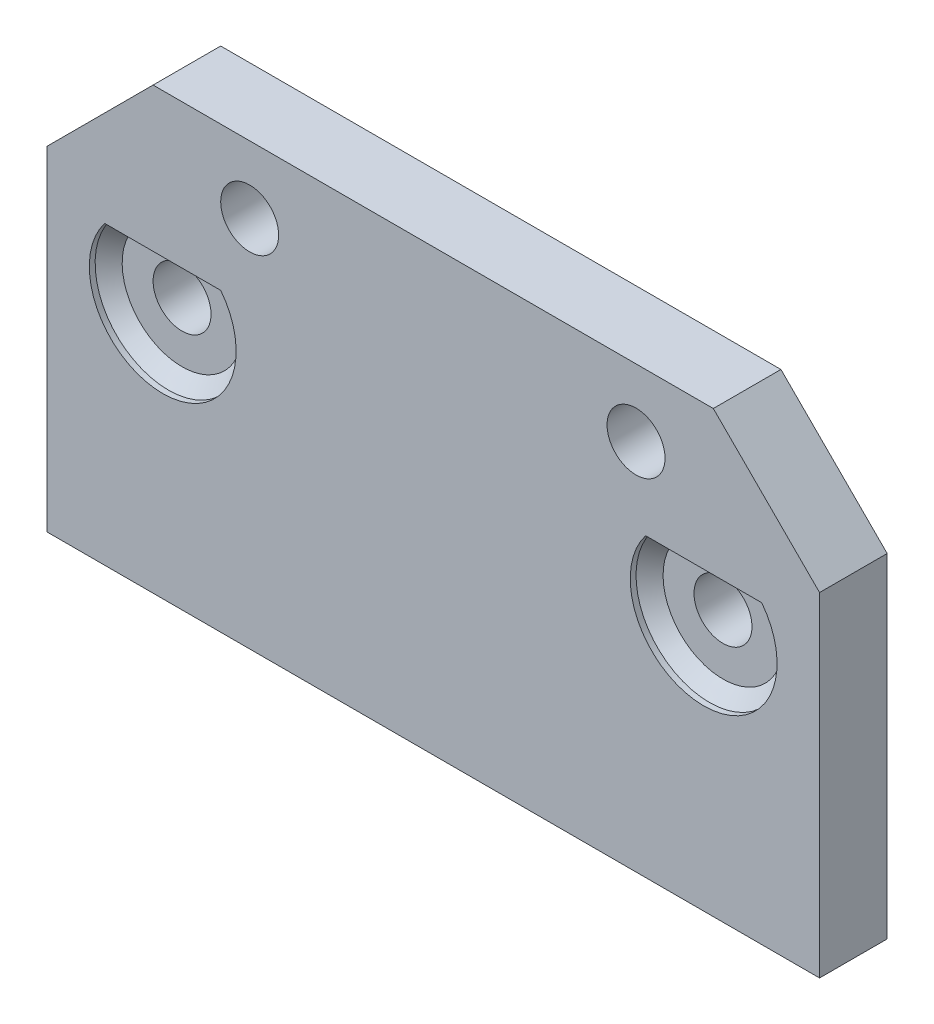
from build123d import *

# Parameters (mm, degrees)
SKETCH_1_W          = 40
SKETCH_1_H          = 2.5
EXTRUDE_1_DEPTH     = 18.5
SKETCH_2_R          = 1.5
CUT_EXTRUDE_1_DEPTH = 33.958808433
SKETCH_3_R          = 1.5
CUT_EXTRUDE_2_DEPTH = 40
SKETCH_4_W          = 40
SKETCH_4_H          = 5.719865779
CUT_EXTRUDE_3_DEPTH = 40
SKETCH_5_W          = 40
SKETCH_5_H          = 12.780134221
EXTRUDE_2_DEPTH     = 1
SKETCH_6_R          = 1.5
CUT_EXTRUDE_4_DEPTH = 31.221927206
SKETCH_8_W          = 40
SKETCH_8_H          = 3.5
EXTRUDE_3_DEPTH     = 5
SKETCH_9_R          = 3.8
CUT_EXTRUDE_5_DEPTH = 1
SKETCH_10_W         = 12
SKETCH_10_H         = 17.780134221
CUT_EXTRUDE_6_DEPTH = 1.5
CHAMFER_3_SIZE      = 0.7
CUT_EXTRUDE_7_DEPTH = 31.221927206
SKETCH_12_W         = 40
SKETCH_12_H         = 1.953894505
EXTRUDE_5_DEPTH     = 2
SKETCH_13_W         = 40
SKETCH_13_H         = 3.5
EXTRUDE_6_DEPTH     = 5
SKETCH_14_W         = 12
SKETCH_14_H         = 4.371099825
EXTRUDE_7_DEPTH     = 2
SKETCH_15_W         = 12
SKETCH_15_H         = 1.544999831
EXTRUDE_8_DEPTH     = 2


with BuildPart() as part:
    # Эскиз1 → Бобышка-Вытянуть1 (new body)
    with BuildSketch(Plane(origin=(0, 0, 0), x_dir=(1, 0, 0), z_dir=(0, 1, 0))):
        with Locations((7.162162162, 1.25)):
            Rectangle(SKETCH_1_W, SKETCH_1_H)
    extrude(amount=EXTRUDE_1_DEPTH)

    # Эскиз2 → Вырез-Вытянуть1 (cut, through all)
    with BuildSketch(Plane.XY):
        with Locations((-6.837837838, 3)):
            Circle(SKETCH_2_R)
        with Locations((21.162162162, 3)):
            Circle(SKETCH_2_R)
    extrude(amount=-CUT_EXTRUDE_1_DEPTH, mode=Mode.SUBTRACT)

    # Эскиз3 → Вырез-Вытянуть2 (cut)
    with BuildSketch(Plane.XY):
        with Locations((-2.337837838, 9.3)):
            Circle(SKETCH_3_R)
        with Locations((17.662162162, 9.3)):
            Circle(SKETCH_3_R)
    extrude(amount=-CUT_EXTRUDE_2_DEPTH, mode=Mode.SUBTRACT)

    # Эскиз4 → Вырез-Вытянуть3 (cut)
    with BuildSketch(Plane.XY):
        with Locations((7.162162162, 15.640067111)):
            Rectangle(SKETCH_4_W, SKETCH_4_H)
    extrude(amount=-CUT_EXTRUDE_3_DEPTH, mode=Mode.SUBTRACT)

    # Эскиз5 → Бобышка-Вытянуть2 (add)
    with BuildSketch(Plane.XY):
        with Locations((7.162162162, 6.390067111)):
            Rectangle(SKETCH_5_W, SKETCH_5_H)
    extrude(amount=EXTRUDE_2_DEPTH)

    # Эскиз6 → Вырез-Вытянуть4 (cut, through all)
    with BuildSketch(Plane(origin=(0, 0, -2.5), x_dir=(-1, 0, 0), z_dir=(0, 0, -1))):
        with Locations(Location((-17.662162162, 9.3, 0), (0, 0, 180))):
            Circle(SKETCH_6_R)
        with Locations(Location((2.337837838, 9.3, 0), (0, 0, 180))):
            Circle(SKETCH_6_R)
        with Locations(Location((6.837837838, 3, 0), (0, 0, 180))):
            Circle(SKETCH_6_R)
        with Locations(Location((-21.162162162, 3, 0), (0, 0, 180))):
            Circle(SKETCH_6_R)
    extrude(amount=-CUT_EXTRUDE_4_DEPTH, mode=Mode.SUBTRACT)

    # Эскиз8 → Бобышка-Вытянуть3 (add)
    with BuildSketch(Plane.XZ):
        with Locations((7.162162162, -0.75)):
            Rectangle(SKETCH_8_W, SKETCH_8_H)
    extrude(amount=EXTRUDE_3_DEPTH)

    # Эскиз9 → Вырез-Вытянуть5 (cut)
    with BuildSketch(Plane.XY.offset(1)):
        with Locations((-6.837837838, 3)):
            Circle(SKETCH_9_R)
        with Locations((21.162162162, 3)):
            Circle(SKETCH_9_R)
    extrude(amount=-CUT_EXTRUDE_5_DEPTH, mode=Mode.SUBTRACT)

    # Эскиз10 → Вырез-Вытянуть6 (cut)
    with BuildSketch(Plane(origin=(0, 0, -2.5), x_dir=(-1, 0, 0), z_dir=(0, 0, -1))):
        with Locations((-7.662162162, 3.890067111)):
            Rectangle(SKETCH_10_W, SKETCH_10_H)
    extrude(amount=-CUT_EXTRUDE_6_DEPTH, mode=Mode.SUBTRACT)

    # Фаска3
    chamfer_3_edges = [part.edges().sort_by_distance(p)[0] for p in [
        (-10.637837838, 3, 0),
        (17.362162162, 3, 0),
    ]]
    chamfer(chamfer_3_edges, length=CHAMFER_3_SIZE)

    # Эскиз11 → Вырез-Вытянуть7 (cut, through all)
    with BuildSketch(Plane.XY.offset(1)):
        Polygon((-12.837837838, 12.780134221), (-12.837837838, 7.280134221), (-7.337837838, 12.780134221), align=None)
        Polygon((27.162162162, 12.780134221), (21.662162162, 12.780134221), (27.162162162, 7.280134221), align=None)
    extrude(amount=-CUT_EXTRUDE_7_DEPTH, mode=Mode.SUBTRACT)

    # Эскиз12 → Бобышка-Вытянуть5 (add)
    with BuildSketch(Plane.XY.offset(1)):
        with Locations((7.162162162, 6.303186969)):
            Rectangle(SKETCH_12_W, SKETCH_12_H)
    extrude(amount=-EXTRUDE_5_DEPTH)

    # Эскиз13 → Бобышка-Вытянуть6 (add)
    with BuildSketch(Plane.XZ.offset(5)):
        with Locations((7.162162162, -0.75)):
            Rectangle(SKETCH_13_W, SKETCH_13_H)
    extrude(amount=EXTRUDE_6_DEPTH)

    # Эскиз14 → Бобышка-Вытянуть7 (add)
    with BuildSketch(Plane(origin=(0, 0, -2.5), x_dir=(-1, 0, 0), z_dir=(0, 0, -1))):
        with Locations((-7.662162162, -2.814450088)):
            Rectangle(SKETCH_14_W, SKETCH_14_H)
    extrude(amount=-EXTRUDE_7_DEPTH)

    # Эскиз15 → Бобышка-Вытянуть8 (add)
    with BuildSketch(Plane(origin=(0, 0, -2.5), x_dir=(-1, 0, 0), z_dir=(0, 0, -1))):
        with Locations((-7.662162162, 12.007634306)):
            Rectangle(SKETCH_15_W, SKETCH_15_H)
    extrude(amount=-EXTRUDE_8_DEPTH)


solid = part.part
